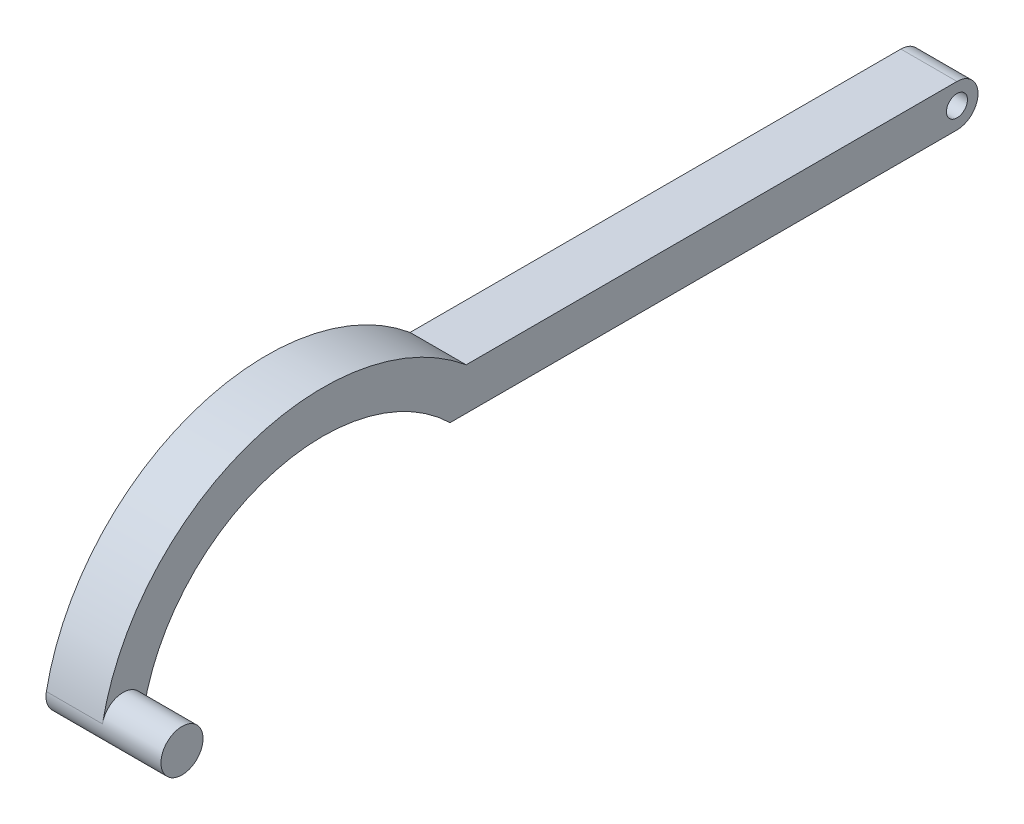
from build123d import *

# Parameters (mm, degrees)
SKETCH1_R           = 0.75
BOSS_EXTRUDE1_DEPTH = 4
SKETCH2_R           = 1.5
BOSS_EXTRUDE2_DEPTH = 4.2


with BuildPart() as part:
    # Sketch1 → Boss-Extrude1 (new body)
    with BuildSketch(Plane(origin=(0, 0, 0), x_dir=(0, 0, -1), z_dir=(1, 0, 0))):
        with BuildLine():
            Line((59.464274989, 9.5), (24.464274989, 9.5))
            ThreePointArc((24.464274989, 9.5), (8.873257316, 12.280607794), (-1.471831597, 0.289329831))
            ThreePointArc((-1.471831597, 0.289329831), (-0.289329829, -1.471831597), (1.471831597, -0.289329827))
            ThreePointArc((1.471831597, -0.289329827), (10.369024088, 9.617273138), (23.31442577, 6.5))
            Line((23.31442577, 6.5), (59.464274989, 6.5))
            ThreePointArc((59.464274989, 6.5), (60.964274989, 8), (59.464274989, 9.5))
        make_face()
        with Locations((59.464274989, 8)):
            Circle(SKETCH1_R, mode=Mode.SUBTRACT)
    extrude(amount=BOSS_EXTRUDE1_DEPTH)

    # Sketch2 → Boss-Extrude2 (add)
    with BuildSketch(Plane(origin=(4, 0, 0), x_dir=(0, 0, -1), z_dir=(1, 0, 0))):
        with Locations(Location((0, 0, 0), (0, 0, 168.878711661))):
            Circle(SKETCH2_R)
    extrude(amount=BOSS_EXTRUDE2_DEPTH)


solid = part.part
